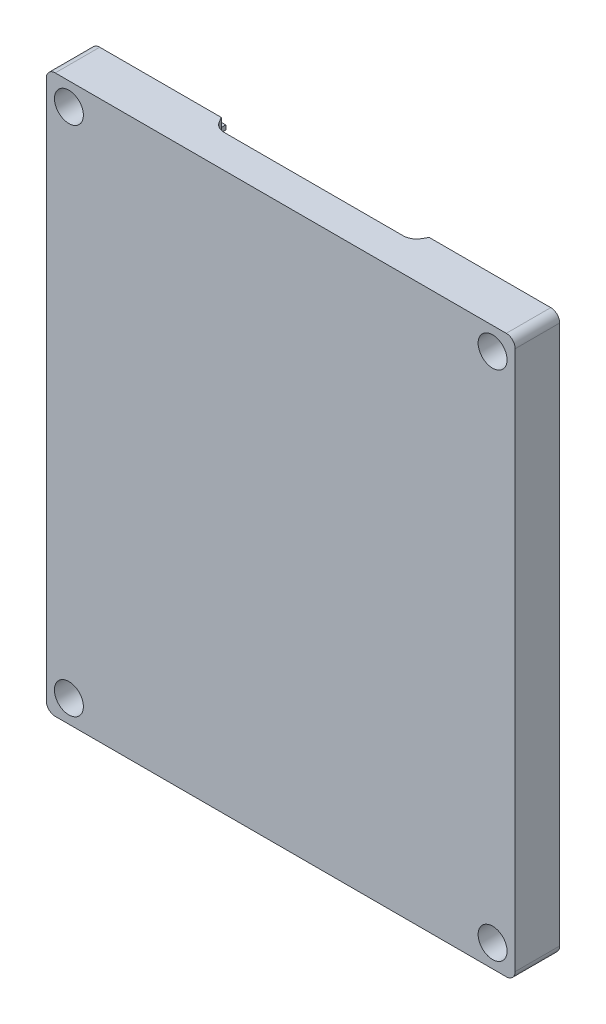
from build123d import *

# Parameters (mm, degrees)
ESQUISSE1_R       = 1.6
WALLS_DEPTH       = 10
CENTRAGE_DEPTH    = 1
PASSAGE_CMC_REACH = 138.205
COUVERCLE_DEPTH   = 2
PASSAGE_M3_START  = -5
ESQUISSE5_R       = 3.25
ESQUISSE5_R_2     = 1.6
PASSAGE_M3_DEPTH  = 5


with BuildPart() as part:
    # Esquisse1 → Walls (new body)
    with BuildSketch(Plane.XY):
        with BuildLine():
            Line((-50.67, 60.555), (50.67, 60.555))
            ThreePointArc((50.67, 60.555), (52.084213562, 59.969213562), (52.67, 58.555))
            Line((52.67, 58.555), (52.67, -62.655))
            ThreePointArc((52.67, -62.655), (52.084213562, -64.069213562), (50.67, -64.655))
            Line((50.67, -64.655), (-50.67, -64.655))
            ThreePointArc((-50.67, -64.655), (-52.084213562, -64.069213562), (-52.67, -62.655))
            Line((-52.67, -62.655), (-52.67, 58.555))
            ThreePointArc((-52.67, 58.555), (-52.084213562, 59.969213562), (-50.67, 60.555))
        make_face()
        with Locations((-47.598784258, -59.583784258)):
            Circle(ESQUISSE1_R, mode=Mode.SUBTRACT)
        with Locations((47.598784258, -59.583784258)):
            Circle(ESQUISSE1_R, mode=Mode.SUBTRACT)
        with Locations((47.598784258, 55.483784258)):
            Circle(ESQUISSE1_R, mode=Mode.SUBTRACT)
        with Locations((-47.598784258, 55.483784258)):
            Circle(ESQUISSE1_R, mode=Mode.SUBTRACT)
        Polygon((-49.72, 46.190786438), (-38.305786438, 57.605), (38.305786438, 57.605), (49.72, 46.190786438), (49.72, -50.290786438), (38.305786438, -61.705), (-38.305786438, -61.705), (-49.72, -50.290786438), align=None, mode=Mode.SUBTRACT)
    extrude(amount=WALLS_DEPTH)

    # Esquisse1<5> → Centrage (add)
    with BuildSketch(Plane.XY):
        Polygon((-50.72, 46.605), (-38.72, 58.605), (38.72, 58.605), (50.72, 46.605), (50.72, -50.705), (38.72, -62.705), (-38.72, -62.705), (-50.72, -50.705), align=None)
        Polygon((-38.305786438, -61.705), (-49.72, -50.290786438), (-49.72, 46.190786438), (-38.305786438, 57.605), (38.305786438, 57.605), (49.72, 46.190786438), (49.72, -50.290786438), (38.305786438, -61.705), align=None, mode=Mode.SUBTRACT)
    extrude(amount=-CENTRAGE_DEPTH)

    # Esquisse2 → Passage_CMC (cut, up to next)
    with BuildSketch(Plane(origin=(0, 60.555, 0), x_dir=(1, 0, 0), z_dir=(0, 1, 0)), mode=Mode.PRIVATE) as passage_cmc_sk1:
        with BuildLine():
            Line((-23.35, 1), (23.35, 1))
            Line((23.35, 1), (23.35, 0))
            Line((23.35, 0), (22.72, -1.1))
            ThreePointArc((22.72, -1.1), (21.621090793, -2.198557375), (20.12, -2.6))
            Line((20.12, -2.6), (-20.12, -2.6))
            ThreePointArc((-20.12, -2.6), (-21.621090793, -2.198557375), (-22.72, -1.1))
            Line((-22.72, -1.1), (-23.35, 0))
            Line((-23.35, 0), (-23.35, 1))
        make_face()
    passage_cmc_tool1 = extrude(passage_cmc_sk1.sketch, amount=-PASSAGE_CMC_REACH, mode=Mode.PRIVATE) & part.part
    add(passage_cmc_tool1.solids().sort_by_distance((0, 60.555, 0.768983))[0], mode=Mode.SUBTRACT)

    # Esquisse4 → Couvercle (add)
    with BuildSketch(Plane.XY.offset(10)):
        Polygon((-49.72, -50.290786438), (-49.72, 46.190786438), (-38.305786438, 57.605), (38.305786438, 57.605), (49.72, 46.190786438), (49.72, -50.290786438), (38.305786438, -61.705), (-38.305786438, -61.705), align=None)
    extrude(amount=-COUVERCLE_DEPTH)

    # Esquisse5 → Passage_M3 (cut)
    # profile 1 of 4: a face of its own
    with BuildSketch(Plane.XY.offset(10).offset(PASSAGE_M3_START)):
        with Locations((-47.598784258, -59.583784258)):
            Circle(ESQUISSE5_R)
        with Locations((-47.598784258, -59.583784258)):
            Circle(ESQUISSE5_R_2, mode=Mode.SUBTRACT)
    # profile 2 of 4: a face of its own
    with BuildSketch(Plane.XY.offset(10).offset(PASSAGE_M3_START)):
        with Locations((-47.598784258, 55.483784258)):
            Circle(ESQUISSE5_R)
        with Locations((-47.598784258, 55.483784258)):
            Circle(ESQUISSE5_R_2, mode=Mode.SUBTRACT)
    # profile 3 of 4: a face of its own
    with BuildSketch(Plane.XY.offset(10).offset(PASSAGE_M3_START)):
        with Locations(Location((47.598784258, 55.483784258, 0), (0, 0, 180))):
            Circle(ESQUISSE5_R)
        with Locations(Location((47.598784258, 55.483784258, 0), (0, 0, 180))):
            Circle(ESQUISSE5_R_2, mode=Mode.SUBTRACT)
    # profile 4 of 4: a face of its own
    with BuildSketch(Plane.XY.offset(10).offset(PASSAGE_M3_START)):
        with Locations(Location((47.598784258, -59.583784258, 0), (0, 0, 180))):
            Circle(ESQUISSE5_R)
        with Locations(Location((47.598784258, -59.583784258, 0), (0, 0, 180))):
            Circle(ESQUISSE5_R_2, mode=Mode.SUBTRACT)
    extrude(amount=PASSAGE_M3_DEPTH, mode=Mode.SUBTRACT)


solid = part.part
